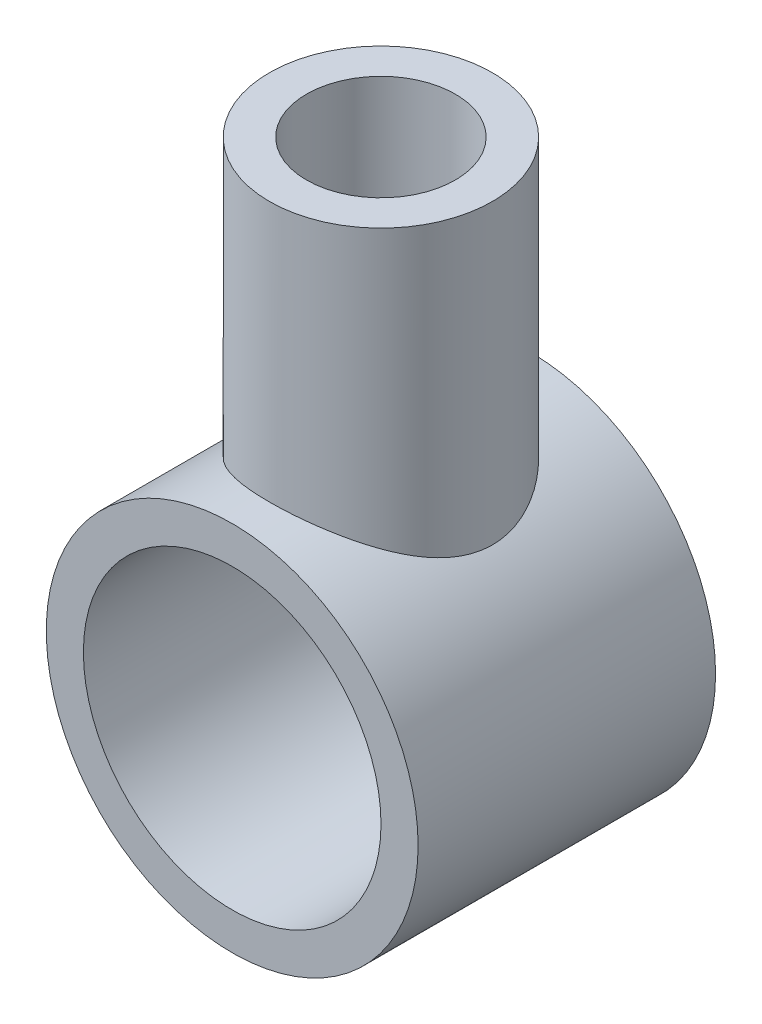
from build123d import *

# Parameters (mm, degrees)
SKETCH3_R                = 7.5
BOSS_EXTRUDE1_DEPTH      = 22
BOSS_EXTRUDE2_DEPTH      = 10
BOSS_EXTRUDE2_DEPTH_BACK = 10
SKETCH1_R                = 12.5
SKETCH6_R                = 10.005
CUT_EXTRUDE1_DEPTH       = 49
SKETCH5_R                = 5.005
CUT_EXTRUDE2_DEPTH       = 15


with BuildPart() as part:
    # Sketch3 → Boss-Extrude1 (new body)
    with BuildSketch(Plane(origin=(0, 30, 0), x_dir=(1, 0, 0), z_dir=(0, 1, 0))):
        with Locations(Location((0, 0, 0), (0, 0, 270))):
            Circle(SKETCH3_R)
    extrude(amount=-BOSS_EXTRUDE1_DEPTH)

    # Sketch1 → Boss-Extrude2 (add, two sides: drawn at the far end of the back side and taken through both)
    with BuildSketch(Plane.XY.offset(-BOSS_EXTRUDE2_DEPTH_BACK)):
        Circle(SKETCH1_R)
    extrude(amount=BOSS_EXTRUDE2_DEPTH + BOSS_EXTRUDE2_DEPTH_BACK)

    # Sketch6 → Cut-Extrude1 (cut)
    with BuildSketch(Plane(origin=(0, 0, -10), x_dir=(-1, 0, 0), z_dir=(0, 0, -1))):
        Circle(SKETCH6_R)
    extrude(amount=-CUT_EXTRUDE1_DEPTH, mode=Mode.SUBTRACT)

    # Sketch5 → Cut-Extrude2 (cut)
    with BuildSketch(Plane(origin=(0, 30, 0), x_dir=(1, 0, 0), z_dir=(0, 1, 0))):
        with Locations(Location((0, 0, 0), (0, 0, 270))):
            Circle(SKETCH5_R)
    extrude(amount=-CUT_EXTRUDE2_DEPTH, mode=Mode.SUBTRACT)


solid = part.part
